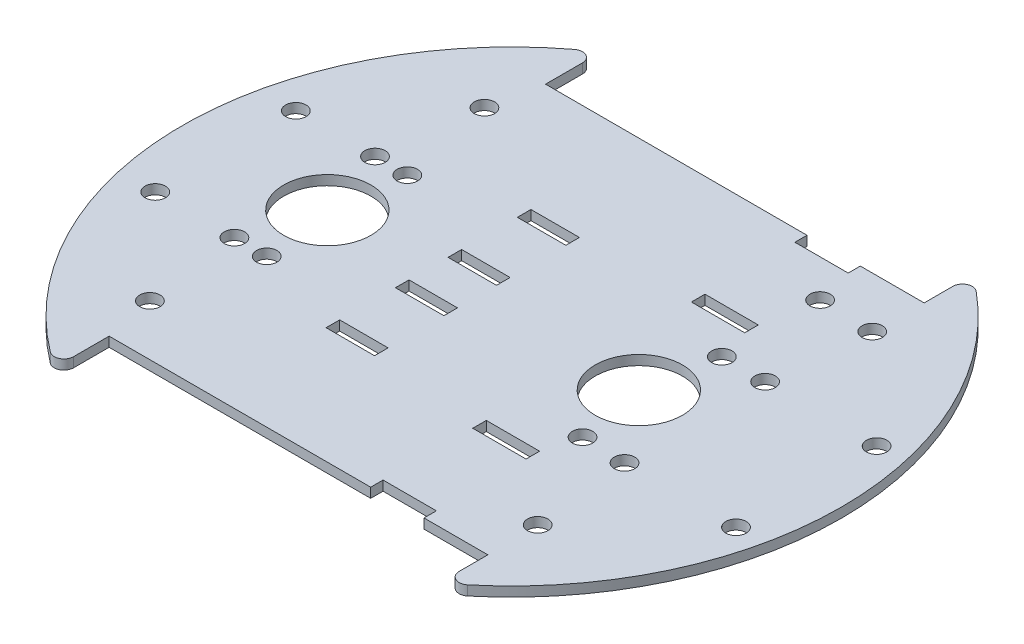
from build123d import *

# Parameters (mm, degrees)
SKETCH1_R           = 2.1
SKETCH1_R_2         = 9
SKETCH1_W           = 11
SKETCH1_H           = 2.8
BOSS_EXTRUDE2_DEPTH = 2
FILLET2_R           = 2
FILLET3_R           = 2
FILLET4_R           = 2
FILLET5_R           = 2


with BuildPart() as part:
    # Sketch1 → Boss-Extrude2 (new body)
    with BuildSketch(Plane(origin=(0, 0, 0), x_dir=(1, 0, 0), z_dir=(0, 1, 0))):
        with BuildLine():
            Line((-37.900233161, -45.013744243), (-37.900233161, -56.220541455))
            ThreePointArc((-37.900233161, -56.220541455), (-67.973978104, 0.144116575), (-37.900233161, 56.508774605))
            Line((-37.900233161, 56.508774605), (-37.900233161, 45.013744243))
            Line((-37.900233161, 45.013744243), (16.055748962, 44.986255757))
            Line((16.055748962, 44.986255757), (16.055748962, 42.486255757))
            Line((16.055748962, 42.486255757), (27.055748962, 42.486255757))
            Line((27.055748962, 42.486255757), (27.055748962, 44.986255757))
            Line((27.055748962, 44.986255757), (40.223874261, 44.986255757))
            Line((40.223874261, 44.986255757), (40.223874261, 54.986255757))
            ThreePointArc((40.223874261, 54.986255757), (68.16767133, -0.013744243), (40.223874261, -55.013744243))
            Line((40.223874261, -55.013744243), (40.223874261, -45.013744243))
            Line((40.223874261, -45.013744243), (27.055748962, -45.013744243))
            Line((27.055748962, -45.013744243), (27.055748962, -42.465581387))
            Line((27.055748962, -42.465581387), (16.055748962, -42.465581387))
            Line((16.055748962, -42.465581387), (16.055748962, -45.013744243))
            Line((16.055748962, -45.013744243), (-37.900233161, -45.013744243))
        make_face()
        with Locations(Location((40.004613264, -34.516033797, 0), (0, 0, 270))):
            Circle(SKETCH1_R, mode=Mode.SUBTRACT)
        with Locations(Location((40.000233161, 34.5, 0), (0, 0, 90))):
            Circle(SKETCH1_R, mode=Mode.SUBTRACT)
        with Locations(Location((37.900233161, -14.5, 0), (0, 0, 270))):
            Circle(SKETCH1_R, mode=Mode.SUBTRACT)
        with Locations(Location((37.900233161, 14.5, 0), (0, 0, 90))):
            Circle(SKETCH1_R, mode=Mode.SUBTRACT)
        with Locations(Location((60.900233161, 14.5, 0), (0, 0, 270))):
            Circle(SKETCH1_R, mode=Mode.SUBTRACT)
        with Locations(Location((60.900233161, -14.5, 0), (0, 0, 90))):
            Circle(SKETCH1_R, mode=Mode.SUBTRACT)
        with Locations(Location((-40.000233161, -34.5, 0), (0, 0, 90))):
            Circle(SKETCH1_R, mode=Mode.SUBTRACT)
        with Locations(Location((-35.900233161, -14.5, 0), (0, 0, 90))):
            Circle(SKETCH1_R, mode=Mode.SUBTRACT)
        with Locations(Location((-58.900233161, -14.5, 0), (0, 0, 270))):
            Circle(SKETCH1_R, mode=Mode.SUBTRACT)
        with Locations(Location((-58.900233161, 14.5, 0), (0, 0, 90))):
            Circle(SKETCH1_R, mode=Mode.SUBTRACT)
        with Locations(Location((-35.900233161, 14.5, 0), (0, 0, 270))):
            Circle(SKETCH1_R, mode=Mode.SUBTRACT)
        with Locations(Location((-40.000233161, 34.5, 0), (0, 0, 270))):
            Circle(SKETCH1_R, mode=Mode.SUBTRACT)
        with Locations(Location((26.366427779, -0.013744243, 0), (0, 0, 270))):
            Circle(SKETCH1_R_2, mode=Mode.SUBTRACT)
        with Locations(Location((-37.900233161, 0, 0), (0, 0, 270))):
            Circle(SKETCH1_R_2, mode=Mode.SUBTRACT)
        with Locations(Location((28.973777757, -14.234221967, 0), (0, 0, 270))):
            Circle(SKETCH1_R, mode=Mode.SUBTRACT)
        with Locations(Location((28.973777757, 14.5, 0), (0, 0, 90))):
            Circle(SKETCH1_R, mode=Mode.SUBTRACT)
        with Locations(Location((28.973777757, 34.770177046, 0), (0, 0, 270))):
            Circle(SKETCH1_R, mode=Mode.SUBTRACT)
        with Locations(Location((-42.568753496, -14.5, 0), (0, 0, 270))):
            Circle(SKETCH1_R, mode=Mode.SUBTRACT)
        with Locations(Location((-42.568753496, 14.5, 0), (0, 0, 90))):
            Circle(SKETCH1_R, mode=Mode.SUBTRACT)
        Polygon((-17.02036954, 21.11975573), (-17.019395908, 18.319755899), (-7.019396513, 18.323233156), (-7.020370144, 21.123232986), align=None, mode=Mode.SUBTRACT)
        with Locations((21.555748962, -22.565581387)):
            Rectangle(SKETCH1_W, SKETCH1_H, mode=Mode.SUBTRACT)
        with Locations((21.555748962, 22.5380929)):
            Rectangle(SKETCH1_W, SKETCH1_H, mode=Mode.SUBTRACT)
        Polygon((-17.022091972, -4.030680267), (-17.022315971, -6.830680258), (-7.022316003, -6.831480257), (-7.022092004, -4.031480266), align=None, mode=Mode.SUBTRACT)
        Polygon((-17.02036954, 4.02323402), (-7.020370144, 4.019756764), (-7.019396513, 6.819756595), (-17.019395908, 6.823233851), align=None, mode=Mode.SUBTRACT)
        Polygon((-17.029404589, -21.127200413), (-7.029407596, -21.134954923), (-7.027236333, -18.334955765), (-17.027233326, -18.327201255), align=None, mode=Mode.SUBTRACT)
    extrude(amount=BOSS_EXTRUDE2_DEPTH)

    # Fillet2
    fillet2_edges = [part.edges().sort_by_distance(p)[0] for p in [
        (-37.900233161, 1, -56.508774605),
    ]]
    fillet(fillet2_edges, radius=FILLET2_R)

    # Fillet3
    fillet3_edges = [part.edges().sort_by_distance(p)[0] for p in [
        (40.223874261, 1, -54.986255757),
    ]]
    fillet(fillet3_edges, radius=FILLET3_R)

    # Fillet4
    fillet4_edges = [part.edges().sort_by_distance(p)[0] for p in [
        (40.223874261, 1, 55.013744243),
    ]]
    fillet(fillet4_edges, radius=FILLET4_R)

    # Fillet5
    fillet5_edges = [part.edges().sort_by_distance(p)[0] for p in [
        (-37.900233161, 1, 56.220541455),
    ]]
    fillet(fillet5_edges, radius=FILLET5_R)


solid = part.part
